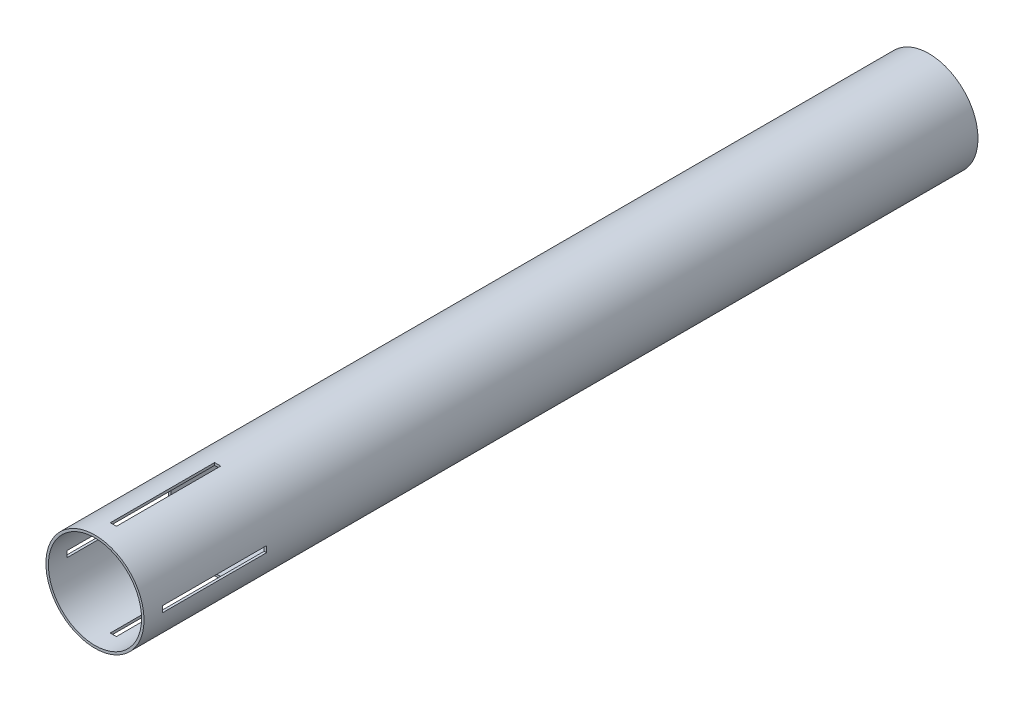
from build123d import *
from build123d.topology import SkipClean

# Parameters (mm, degrees)
SKETCH1_R           = 50.8
SKETCH1_R_2         = 48.26
BOSS_EXTRUDE1_DEPTH = 863.6
CUT_EXTRUDE1_START  = -127
CUT_EXTRUDE1_DEPTH  = 127
BOSS_EXTRUDE2_START = -19.05
BOSS_EXTRUDE2_DEPTH = 19.05


with BuildPart() as part:
    # Sketch1 → Boss-Extrude1 (new body)
    with BuildSketch(Plane.XY):
        Circle(SKETCH1_R)
        Circle(SKETCH1_R_2, mode=Mode.SUBTRACT)
    extrude(amount=BOSS_EXTRUDE1_DEPTH)

    # Sketch2 → Cut-Extrude1 (cut)
    with BuildSketch(Plane.XY.offset(863.6).offset(CUT_EXTRUDE1_START)):
        with BuildLine():
            Line((-3.175, 50.700684167), (-3.175, 48.155445954))
            ThreePointArc((-3.175, 48.155445954), (0, 48.26), (3.175, 48.155445954))
            Line((3.175, 48.155445954), (3.175, 50.700684167))
            ThreePointArc((3.175, 50.700684167), (0, 50.8), (-3.175, 50.700684167))
        make_face()
        with BuildLine():
            Line((-50.700684167, 3.175), (-48.155445954, 3.175))
            ThreePointArc((-48.155445954, 3.175), (-48.26, 0), (-48.155445954, -3.175))
            Line((-48.155445954, -3.175), (-50.700684167, -3.175))
            ThreePointArc((-50.700684167, -3.175), (-50.8, 0), (-50.700684167, 3.175))
        make_face()
        with BuildLine():
            Line((48.155445954, 3.175), (50.700684167, 3.175))
            ThreePointArc((50.700684167, 3.175), (50.8, 0), (50.700684167, -3.175))
            Line((50.700684167, -3.175), (48.155445954, -3.175))
            ThreePointArc((48.155445954, -3.175), (48.26, 0), (48.155445954, 3.175))
        make_face()
        with BuildLine():
            Line((3.175, -48.155445954), (3.175, -50.700684167))
            ThreePointArc((3.175, -50.700684167), (0, -50.8), (-3.175, -50.700684167))
            Line((-3.175, -50.700684167), (-3.175, -48.155445954))
            ThreePointArc((-3.175, -48.155445954), (0, -48.26), (3.175, -48.155445954))
        make_face()
    extrude(amount=CUT_EXTRUDE1_DEPTH, mode=Mode.SUBTRACT)

    # Sketch4 → Boss-Extrude2 (add)
    with SkipClean():  # the faces are left unmerged after this step: merging them gives an invalid solid
        with BuildSketch(Plane.XY.offset(863.6).offset(BOSS_EXTRUDE2_START)):
            with BuildLine():
                Line((-3.175, 50.700684167), (-3.175, 48.155445954))
                ThreePointArc((-3.175, 48.155445954), (0, 48.26), (3.175, 48.155445954))
                Line((3.175, 48.155445954), (3.175, 50.700684167))
                ThreePointArc((3.175, 50.700684167), (0, 50.8), (-3.175, 50.700684167))
            make_face()
            with BuildLine():
                Line((50.700684167, 3.175), (48.155445954, 3.175))
                ThreePointArc((48.155445954, 3.175), (48.26, 0), (48.155445954, -3.175))
                Line((48.155445954, -3.175), (50.700684167, -3.175))
                ThreePointArc((50.700684167, -3.175), (50.8, 0), (50.700684167, 3.175))
            make_face()
            with BuildLine():
                Line((3.175, -50.700684167), (3.175, -48.155445954))
                ThreePointArc((3.175, -48.155445954), (0, -48.26), (-3.175, -48.155445954))
                Line((-3.175, -48.155445954), (-3.175, -50.700684167))
                ThreePointArc((-3.175, -50.700684167), (0, -50.8), (3.175, -50.700684167))
            make_face()
            with BuildLine():
                Line((-48.155445954, 3.175), (-50.700684167, 3.175))
                ThreePointArc((-50.700684167, 3.175), (-50.8, 0), (-50.700684167, -3.175))
                Line((-50.700684167, -3.175), (-48.155445954, -3.175))
                ThreePointArc((-48.155445954, -3.175), (-48.26, 0), (-48.155445954, 3.175))
            make_face()
        extrude(amount=BOSS_EXTRUDE2_DEPTH)


solid = part.part
